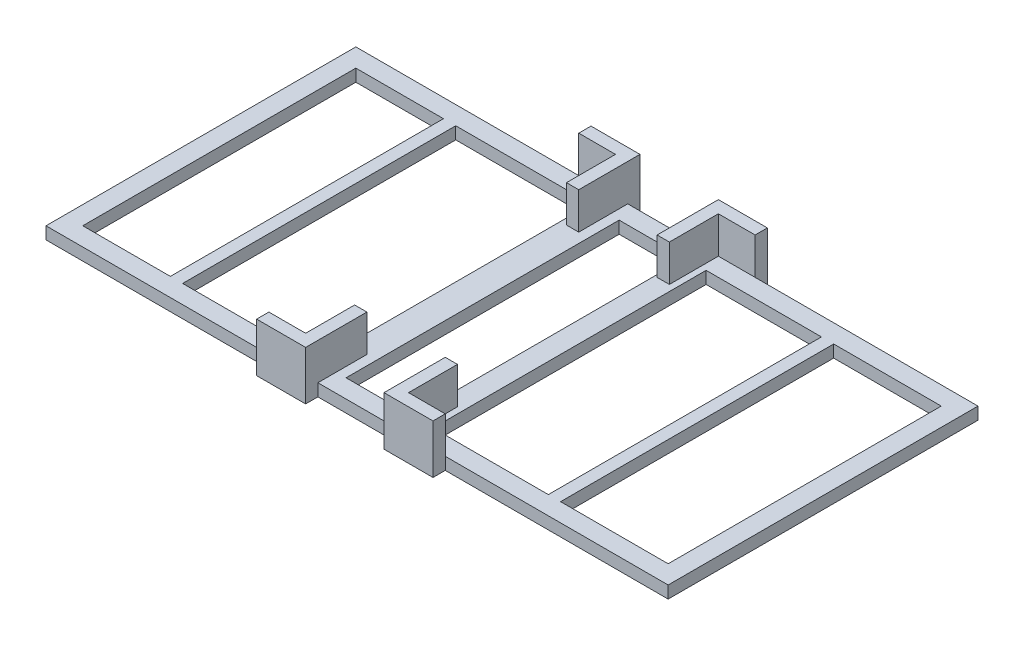
from build123d import *

# Parameters (mm, degrees)
SKETCH_1_W          = 50.8
SKETCH_1_H          = 25.3
EXTRUDE_1_DEPTH     = 1
SKETCH_3_W          = 1
SKETCH_3_H          = 4
EXTRUDE_3_DEPTH     = 3
SKETCH_4_W          = 4
SKETCH_4_H          = 4
EXTRUDE_5_DEPTH     = 1
SKETCH_5_W          = 4
SKETCH_5_H          = 4
EXTRUDE_6_DEPTH     = 1
SKETCH_6_W          = 8.783145701
SKETCH_6_H          = 22.3
SKETCH_6_W_2        = 7.155556096
SKETCH_6_W_3        = 5.4
CUT_EXTRUDE_1_DEPTH = 58.343962193


with BuildPart() as part:
    # 草图1 → 凸台-拉伸1 (new body)
    with BuildSketch(Plane(origin=(0, 0, 0), x_dir=(1, 0, 0), z_dir=(0, 1, 0))):
        with Locations((25.4, -12.65)):
            Rectangle(SKETCH_1_W, SKETCH_1_H)
    extrude(amount=EXTRUDE_1_DEPTH)

    # 草图3 → 凸台-拉伸3 (add)
    with BuildSketch(Plane(origin=(0, 1, 0), x_dir=(1, 0, 0), z_dir=(0, 1, 0))):
        with Locations((21.7, -23.3)):
            Rectangle(SKETCH_3_W, SKETCH_3_H)
        with Locations((21.7, -2)):
            Rectangle(SKETCH_3_W, SKETCH_3_H)
        with Locations((29.1, -2)):
            Rectangle(SKETCH_3_W, SKETCH_3_H)
        with Locations((29.1, -23.3)):
            Rectangle(SKETCH_3_W, SKETCH_3_H)
    extrude(amount=EXTRUDE_3_DEPTH)

    # 草图4 → 凸台-拉伸5 (add)
    with BuildSketch(Plane.XY.offset(25.3)):
        with Locations((20.2, 2)):
            Rectangle(SKETCH_4_W, SKETCH_4_H)
        with Locations((30.6, 2)):
            Rectangle(SKETCH_4_W, SKETCH_4_H)
    extrude(amount=EXTRUDE_5_DEPTH)

    # 草图5 → 凸台-拉伸6 (add)
    with BuildSketch(Plane(origin=(0, 0, 0), x_dir=(-1, 0, 0), z_dir=(0, 0, -1))):
        with Locations((-20.2, 2)):
            Rectangle(SKETCH_5_W, SKETCH_5_H)
        with Locations((-30.6, 2)):
            Rectangle(SKETCH_5_W, SKETCH_5_H)
    extrude(amount=EXTRUDE_6_DEPTH)

    # 草图6 → 切除-拉伸1 (cut, through all)
    with BuildSketch(Plane.XZ):
        Polygon((20.7, 1.5), (19.7, 1.5), (9.655556096, 1.5), (9.655556096, 23.8), (19.7, 23.8), (20.7, 23.8), align=None)
        Polygon((30.1, 23.8), (31.1, 23.8), (39.516854299, 23.8), (39.516854299, 1.5), (31.1, 1.5), (30.1, 1.5), align=None)
        with Locations((44.908427149, 12.65)):
            Rectangle(SKETCH_6_W, SKETCH_6_H)
        with Locations((5.077778048, 12.65)):
            Rectangle(SKETCH_6_W_2, SKETCH_6_H)
        with Locations((25.7, 12.65)):
            Rectangle(SKETCH_6_W_3, SKETCH_6_H)
    extrude(amount=-CUT_EXTRUDE_1_DEPTH, mode=Mode.SUBTRACT)


solid = part.part
